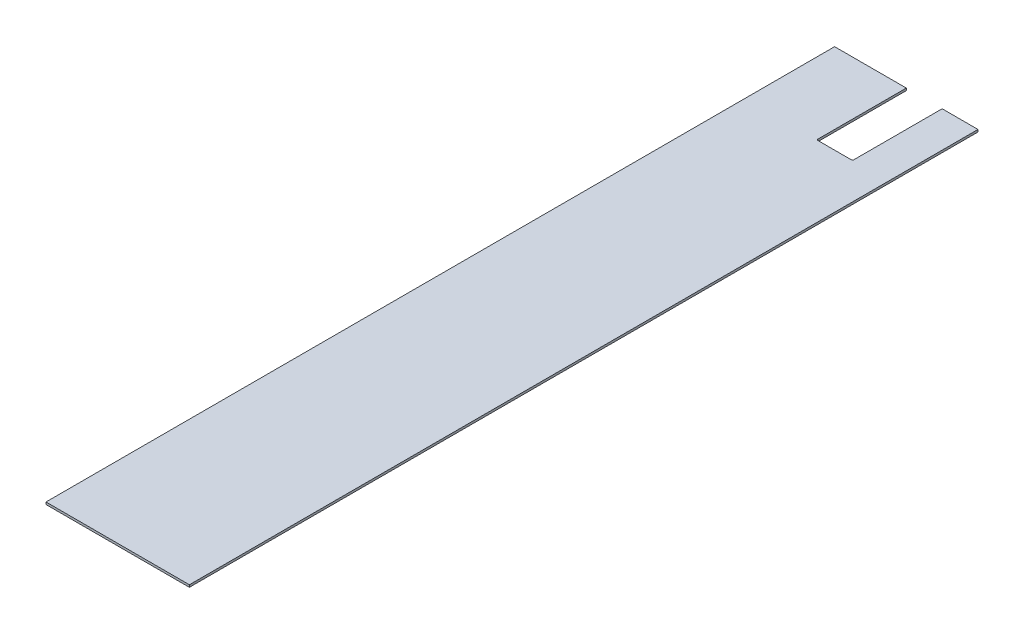
from build123d import *

# Parameters (mm, degrees)
BOSS_EXTRUDE1_DEPTH = 6.35


with BuildPart() as part:
    # Sketch1 → Boss-Extrude1 (new body)
    with BuildSketch(Plane(origin=(0, 0, 0), x_dir=(1, 0, 0), z_dir=(0, 1, 0))):
        with BuildLine():
            Line((0, 1117.6), (0, 866.775))
            ThreePointArc((0, 866.775), (0.92993597, 864.52993597), (3.175, 863.6))
            Line((3.175, 863.6), (98.425, 863.6))
            ThreePointArc((98.425, 863.6), (100.67006403, 864.52993597), (101.6, 866.775))
            Line((101.6, 866.775), (101.6, 1117.6))
            Line((101.6, 1117.6), (203.2, 1117.6))
            Line((203.2, 1117.6), (203.2, -1117.6))
            Line((203.2, -1117.6), (-203.2, -1117.6))
            Line((-203.2, -1117.6), (-203.2, 1117.6))
            Line((-203.2, 1117.6), (0, 1117.6))
        make_face()
    extrude(amount=BOSS_EXTRUDE1_DEPTH)


solid = part.part
